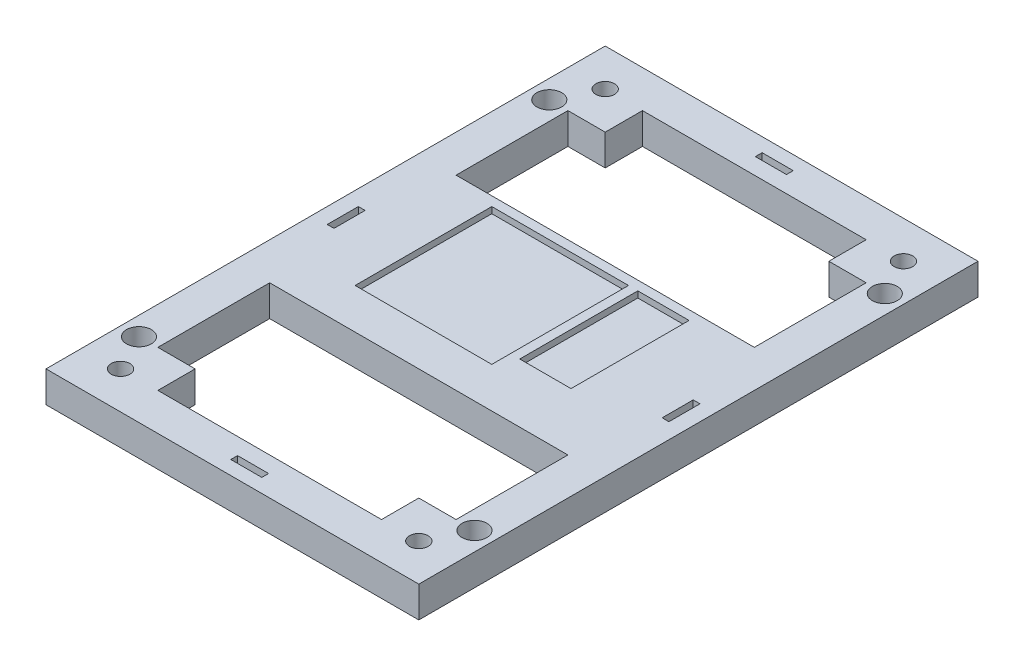
from build123d import *

# Parameters (mm, degrees)
SKETCH1_W           = 120
SKETCH1_H           = 180
SKETCH1_R           = 3
BOSS_EXTRUDE1_DEPTH = 10
SKETCH2_W           = 96
SKETCH2_H           = 60
BOSS_EXTRUDE2_DEPTH = 10
SKETCH8_R           = 4
SKETCH8_W           = 2.177957771
SKETCH8_H           = 10
SKETCH8_W_2         = 10
SKETCH8_H_2         = 2.18
CUT_EXTRUDE8_DEPTH  = 231.705439901
SKETCH7_W           = 16.5
SKETCH7_H           = 38
CUT_EXTRUDE7_DEPTH  = 2
SKETCH5_W           = 44
SKETCH5_H           = 44
CUT_EXTRUDE5_DEPTH  = 2


with BuildPart() as part:
    # Sketch1 → Boss-Extrude1 (new body)
    with BuildSketch(Plane(origin=(0, 0, 0), x_dir=(1, 0, 0), z_dir=(0, 1, 0))):
        with Locations((-115, -60)):
            Rectangle(SKETCH1_W, SKETCH1_H)
        with Locations(Location((-163, -138, 0), (0, 0, 270))):
            Circle(SKETCH1_R, mode=Mode.SUBTRACT)
        with Locations(Location((-67, -138, 0), (0, 0, 90))):
            Circle(SKETCH1_R, mode=Mode.SUBTRACT)
        with Locations(Location((-163, 18, 0), (0, 0, 90))):
            Circle(SKETCH1_R, mode=Mode.SUBTRACT)
        with Locations(Location((-67, 18, 0), (0, 0, 270))):
            Circle(SKETCH1_R, mode=Mode.SUBTRACT)
        Polygon((-163, 6), (-163, -126), (-151, -126), (-151, -138), (-79, -138), (-79, -126), (-67, -126), (-67, 6), (-79, 6), (-79, 18), (-151, 18), (-151, 6), align=None, mode=Mode.SUBTRACT)
    extrude(amount=BOSS_EXTRUDE1_DEPTH)

    # Sketch2 → Boss-Extrude2 (add)
    with BuildSketch(Plane(origin=(0, 0, 0), x_dir=(1, 0, 0), z_dir=(0, 1, 0))):
        with Locations((-115, -60)):
            Rectangle(SKETCH2_W, SKETCH2_H)
    extrude(amount=BOSS_EXTRUDE2_DEPTH)

    # Sketch8 → Cut-Extrude8 (cut, through all)
    with BuildSketch(Plane(origin=(0, 10, 0), x_dir=(1, 0, 0), z_dir=(0, 1, 0))):
        with Locations(Location((-169, 6, 0), (0, 0, 270))):
            Circle(SKETCH8_R)
        with Locations(Location((-169, -126.077692428, 0), (0, 0, 90))):
            Circle(SKETCH8_R)
        with Locations(Location((-61, -126.077692428, 0), (0, 0, 270))):
            Circle(SKETCH8_R)
        with Locations(Location((-61, 6, 0), (0, 0, 90))):
            Circle(SKETCH8_R)
        with Locations((-168.898595302, -59.479320644)):
            Rectangle(SKETCH8_W, SKETCH8_H)
        with Locations((-115, 24.434155691)):
            Rectangle(SKETCH8_W_2, SKETCH8_H_2)
        with Locations((-61.101404698, -59.479320644)):
            Rectangle(SKETCH8_W, SKETCH8_H)
        with Locations((-115, -144.434155691)):
            Rectangle(SKETCH8_W_2, SKETCH8_H_2)
    extrude(amount=-CUT_EXTRUDE8_DEPTH, mode=Mode.SUBTRACT)

    # Sketch7 → Cut-Extrude7 (cut)
    with BuildSketch(Plane(origin=(0, 10, 0), x_dir=(1, 0, 0), z_dir=(0, 1, 0))):
        with Locations((-93.25, -52)):
            Rectangle(SKETCH7_W, SKETCH7_H)
    extrude(amount=-CUT_EXTRUDE7_DEPTH, mode=Mode.SUBTRACT)

    # Sketch5 → Cut-Extrude5 (cut)
    with BuildSketch(Plane(origin=(0, 10, 0), x_dir=(1, 0, 0), z_dir=(0, 1, 0))):
        with Locations((-126.5, -55)):
            Rectangle(SKETCH5_W, SKETCH5_H)
    extrude(amount=-CUT_EXTRUDE5_DEPTH, mode=Mode.SUBTRACT)


solid = part.part
